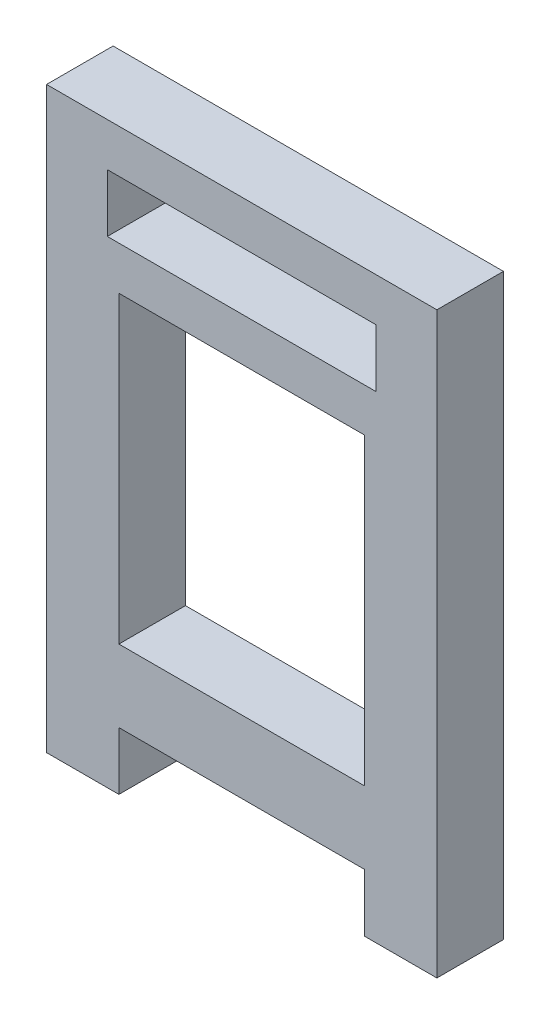
from build123d import *

# Parameters (mm, degrees)
SKETCH1_W           = 8.49
SKETCH1_H           = 10.5
SKETCH1_W_2         = 9.29
SKETCH1_H_2         = 2
BOSS_EXTRUDE1_DEPTH = 2.3


with BuildPart() as part:
    # Sketch1 → Boss-Extrude1 (new body)
    with BuildSketch(Plane.XY):
        Polygon((0, 0), (0, -2), (2.5, -2), (2.5, 0), (10.99, 0), (10.99, -2), (13.49, -2), (13.49, 0), (13.49, 18), (0, 18), align=None)
        with Locations((6.745, 7.75)):
            Rectangle(SKETCH1_W, SKETCH1_H, mode=Mode.SUBTRACT)
        with Locations((6.745, 15.5)):
            Rectangle(SKETCH1_W_2, SKETCH1_H_2, mode=Mode.SUBTRACT)
    extrude(amount=BOSS_EXTRUDE1_DEPTH)


solid = part.part
